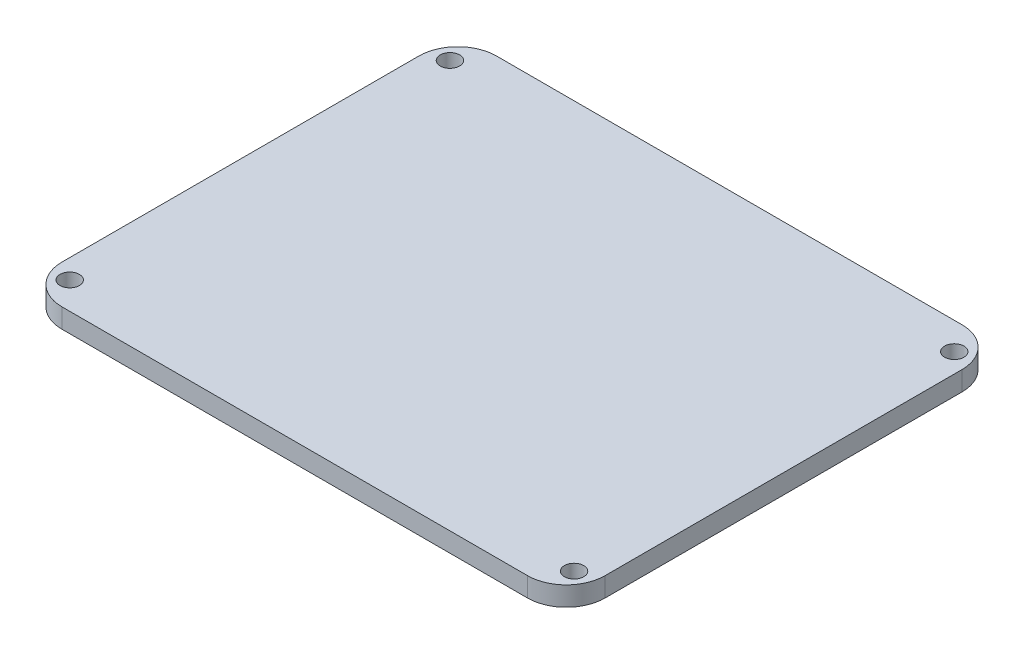
from build123d import *

# Parameters (mm, degrees)
SKETCH1_R           = 1.25
BOSS_EXTRUDE1_DEPTH = 2.5


with BuildPart() as part:
    # Sketch1 → Boss-Extrude1 (new body)
    with BuildSketch(Plane(origin=(0, 0, 0), x_dir=(1, 0, 0), z_dir=(0, 1, 0))):
        with BuildLine():
            Line((-30, 28), (30, 28))
            ThreePointArc((30, 28), (33.535533906, 26.535533906), (35, 23))
            Line((35, 23), (35, -23))
            ThreePointArc((35, -23), (33.535533906, -26.535533906), (30, -28))
            Line((30, -28), (-30, -28))
            ThreePointArc((-30, -28), (-33.535533906, -26.535533906), (-35, -23))
            Line((-35, -23), (-35, 23))
            ThreePointArc((-35, 23), (-33.535533906, 26.535533906), (-30, 28))
        make_face()
        with Locations(Location((-32.5, 24.5, 0), (0, 0, 270))):
            Circle(SKETCH1_R, mode=Mode.SUBTRACT)
        with Locations(Location((32.5, 24.5, 0), (0, 0, 270))):
            Circle(SKETCH1_R, mode=Mode.SUBTRACT)
        with Locations(Location((32.5, -24.5, 0), (0, 0, 270))):
            Circle(SKETCH1_R, mode=Mode.SUBTRACT)
        with Locations(Location((-32.5, -24.5, 0), (0, 0, 270))):
            Circle(SKETCH1_R, mode=Mode.SUBTRACT)
    extrude(amount=BOSS_EXTRUDE1_DEPTH)


solid = part.part
